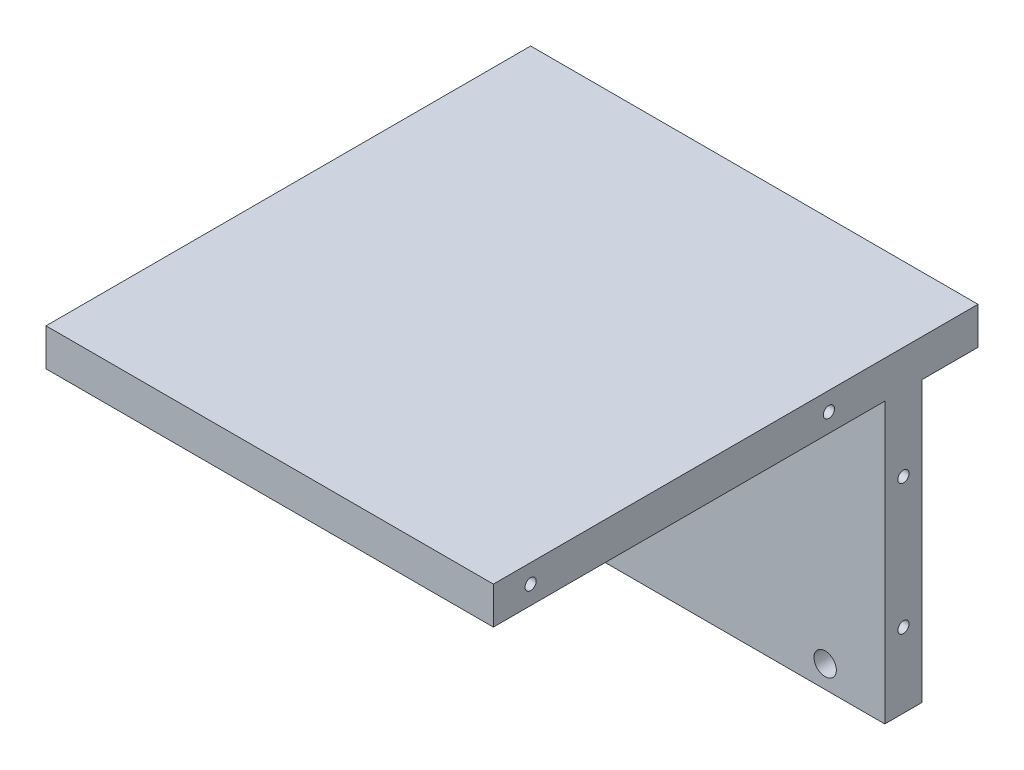
from build123d import *

# Parameters (mm, degrees)
SKETCH1_W           = 120
SKETCH1_H           = 75
SKETCH1_R           = 3
BOSS_EXTRUDE1_DEPTH = 10
SKETCH2_R           = 2.5
CUT_EXTRUDE1_DEPTH  = 7
SKETCH3_R           = 1.5
CUT_EXTRUDE2_DEPTH  = 10
LPATTERN1_COUNT     = 2
LPATTERN1_PITCH     = 110
SKETCH4_W           = 120
SKETCH4_H           = 130
BOSS_EXTRUDE2_DEPTH = 10
SKETCH5_R           = 1.5
CUT_EXTRUDE3_DEPTH  = 10
LPATTERN2_COUNT     = 2
LPATTERN2_PITCH     = 110


with BuildPart() as part:
    # Sketch1 → Boss-Extrude1 (new body)
    with BuildSketch(Plane.XY):
        Rectangle(SKETCH1_W, SKETCH1_H)
        with Locations((-44, 31.5)):
            Circle(SKETCH1_R, mode=Mode.SUBTRACT)
        with Locations((44, 31.5)):
            Circle(SKETCH1_R, mode=Mode.SUBTRACT)
        with Locations((-44, -31.5)):
            Circle(SKETCH1_R, mode=Mode.SUBTRACT)
        with Locations((44, -31.5)):
            Circle(SKETCH1_R, mode=Mode.SUBTRACT)
    extrude(amount=BOSS_EXTRUDE1_DEPTH)

    # Sketch2 → Cut-Extrude1 (cut)
    with BuildSketch(Plane.XY.offset(10)):
        with Locations((0, 10)):
            Circle(SKETCH2_R)
        with Locations((0, -10)):
            Circle(SKETCH2_R)
    extrude(amount=-CUT_EXTRUDE1_DEPTH, mode=Mode.SUBTRACT)

    # Sketch3 → Cut-Extrude2 (cut)
    with BuildSketch(Plane(origin=(60, 0, 0), x_dir=(0, 0, -1), z_dir=(1, 0, 0))):
        with Locations(Location((-5, 17.5, 0), (0, 0, 90))):
            Circle(SKETCH3_R)
        with Locations(Location((-5, -17.5, 0), (0, 0, 90))):
            Circle(SKETCH3_R)
    cut_extrude2 = extrude(amount=-CUT_EXTRUDE2_DEPTH, mode=Mode.SUBTRACT)

    # LPattern1: Cut-Extrude2 ×2
    with Locations(*[(-i * LPATTERN1_PITCH, 0, 0) for i in range(1, LPATTERN1_COUNT)]):
        add(cut_extrude2, mode=Mode.SUBTRACT)

    # Sketch4 → Boss-Extrude2 (add)
    with BuildSketch(Plane(origin=(0, 37.5, 0), x_dir=(1, 0, 0), z_dir=(0, 1, 0))):
        with Locations((0, -50)):
            Rectangle(SKETCH4_W, SKETCH4_H)
    extrude(amount=BOSS_EXTRUDE2_DEPTH)

    # Sketch5 → Cut-Extrude3 (cut)
    with BuildSketch(Plane(origin=(60, 0, 0), x_dir=(0, 0, -1), z_dir=(1, 0, 0))):
        with Locations(Location((-105, 42.5, 0), (0, 0, 90))):
            Circle(SKETCH5_R)
        with Locations(Location((-25, 42.5, 0), (0, 0, 90))):
            Circle(SKETCH5_R)
    cut_extrude3 = extrude(amount=-CUT_EXTRUDE3_DEPTH, mode=Mode.SUBTRACT)

    # LPattern2: Cut-Extrude3 ×2
    with Locations(*[(-i * LPATTERN2_PITCH, 0, 0) for i in range(1, LPATTERN2_COUNT)]):
        add(cut_extrude3, mode=Mode.SUBTRACT)


solid = part.part
